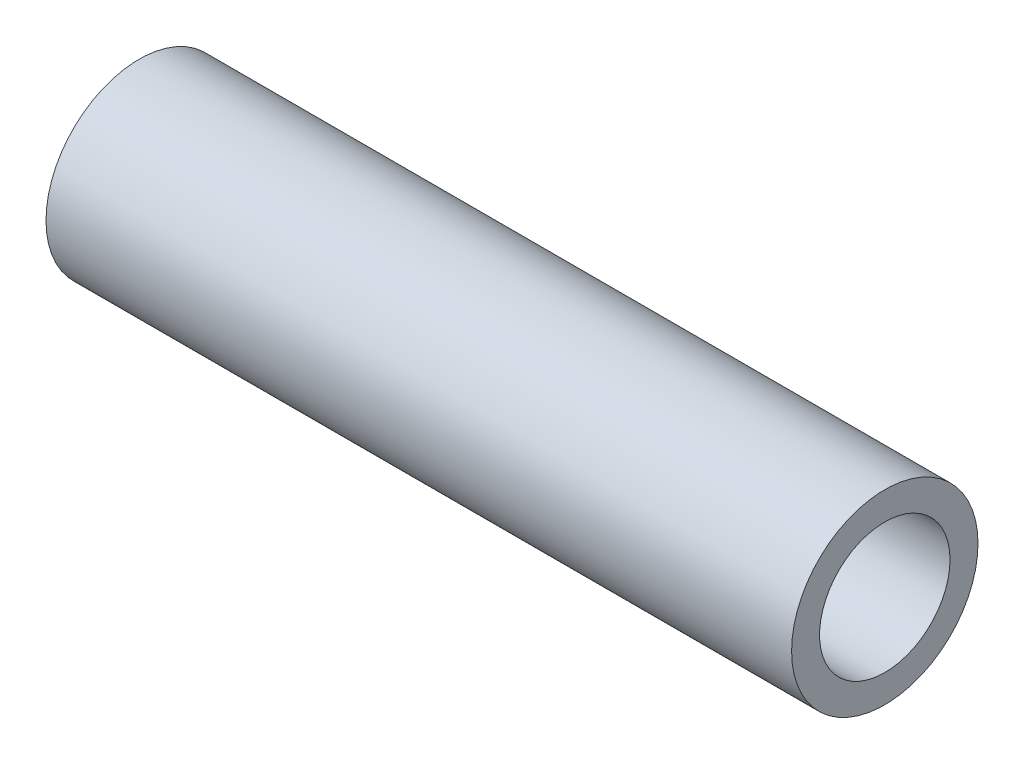
from build123d import *

# Parameters (mm, degrees)
SALIENTE_EXTRUIR1_DEPTH      = 10
SALIENTE_EXTRUIR1_DEPTH_BACK = 10
CROQUIS1_R                   = 2.5
CROQUIS1_R_2                 = 1.75


with BuildPart() as part:
    # Croquis1 → Saliente-Extruir1 (new, two sides: drawn at the far end of the back side and taken through both)
    with BuildSketch(Plane(origin=(0, 0, 0), x_dir=(0, 0, -1), z_dir=(1, 0, 0)).offset(-SALIENTE_EXTRUIR1_DEPTH_BACK)):
        Circle(CROQUIS1_R)
        Circle(CROQUIS1_R_2, mode=Mode.SUBTRACT)
    extrude(amount=SALIENTE_EXTRUIR1_DEPTH + SALIENTE_EXTRUIR1_DEPTH_BACK)


solid = part.part
